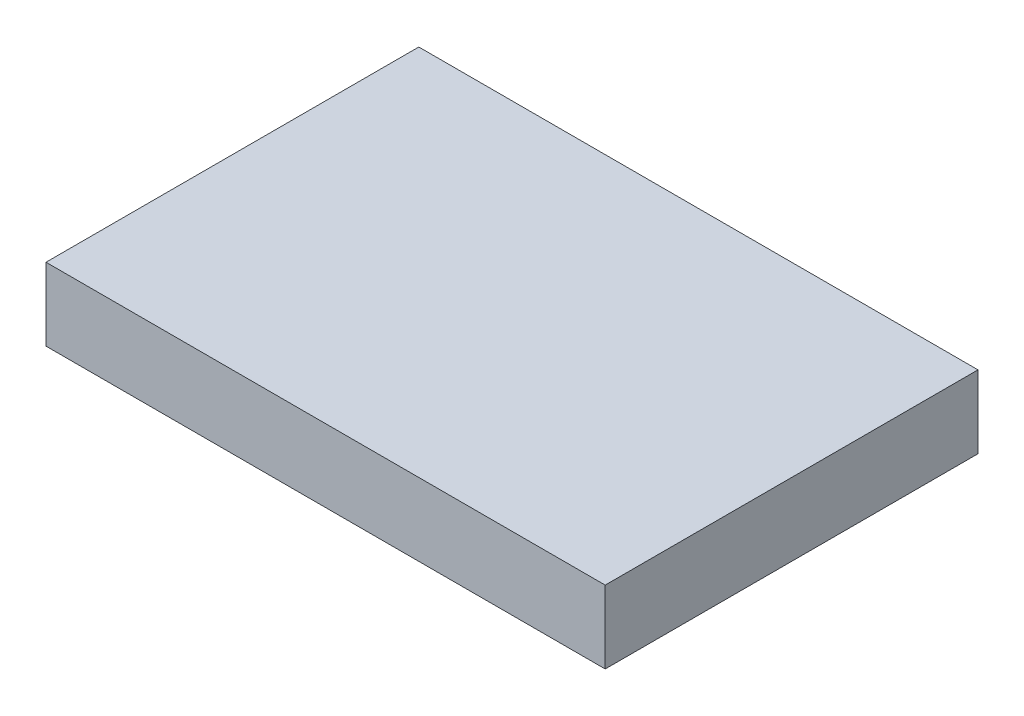
from build123d import *

# Parameters (mm, degrees)
SKETCH1_W           = 23.85
SKETCH1_H           = 15.9
BOSS_EXTRUDE1_DEPTH = 3.1
SHELL1_T            = -1.2
SKETCH2_R           = 3.2
SKETCH2_R_2         = 2.4
BOSS_EXTRUDE2_DEPTH = 1.9
LPATTERN1_COUNT     = 2
LPATTERN1_PITCH     = 8


with BuildPart() as part:
    # Sketch1 → Boss-Extrude1 (new body)
    with BuildSketch(Plane(origin=(0, 0, 0), x_dir=(1, 0, 0), z_dir=(0, 1, 0))):
        Rectangle(SKETCH1_W, SKETCH1_H)
    extrude(amount=BOSS_EXTRUDE1_DEPTH)

    # Shell1
    shell1_openings = [part.faces().sort_by_distance(p)[0] for p in [
        (0, 0, 0),
    ]]
    offset(amount=SHELL1_T, openings=shell1_openings, kind=Kind.INTERSECTION)

    # Sketch2 → Boss-Extrude2 (add)
    with BuildSketch(Plane.XZ.offset(-1.9)):
        with Locations(Location((3.975, 0, 0), (0, 0, 270))):
            Circle(SKETCH2_R)
        with Locations(Location((3.975, 0, 0), (0, 0, 270))):
            Circle(SKETCH2_R_2, mode=Mode.SUBTRACT)
    boss_extrude2 = extrude(amount=BOSS_EXTRUDE2_DEPTH)

    # LPattern1: Boss-Extrude2 ×2
    with Locations(*[(-i * LPATTERN1_PITCH, 0, 0) for i in range(1, LPATTERN1_COUNT)]):
        add(boss_extrude2)


solid = part.part
